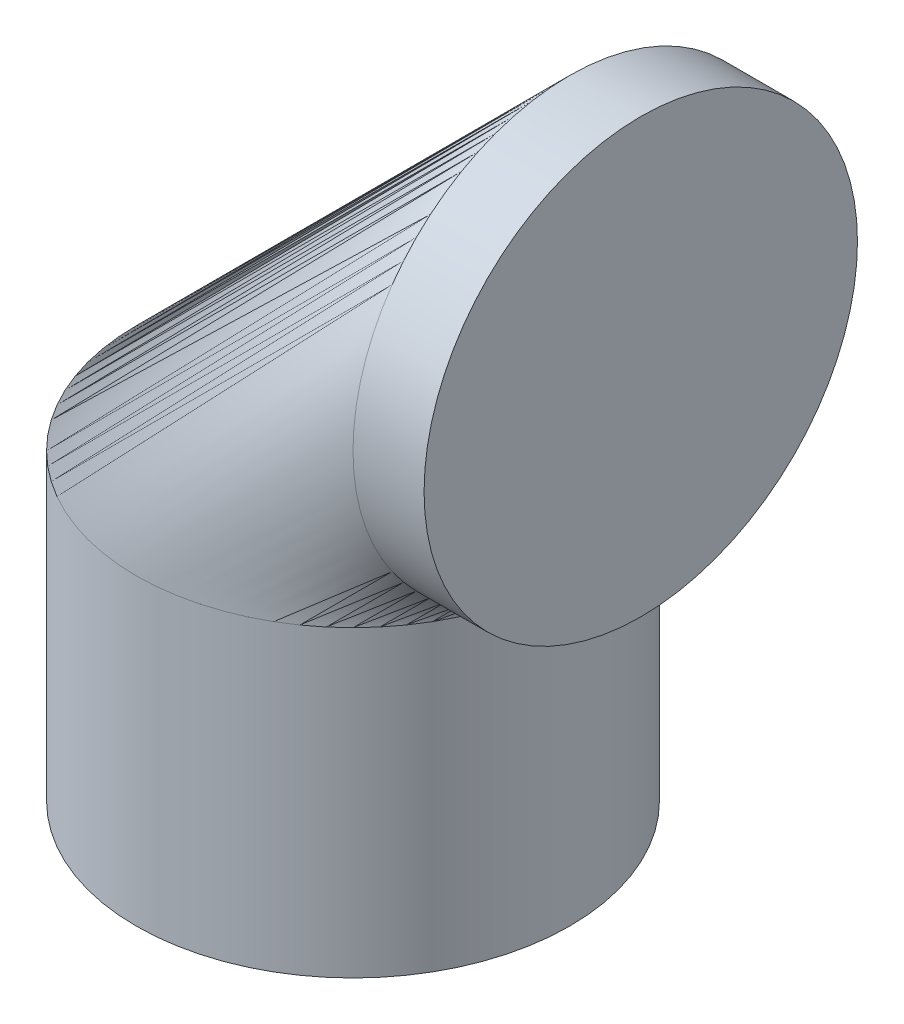
from build123d import *

# Parameters (mm, degrees)
SKETCH5_R = 25


with BuildPart() as part:
    # Sweep2: sweep along a path in Sketch4
    with BuildLine(Plane.XY) as sweep2_path:
        Line((0, 0), (0, 35))
        ThreePointArc((0, 35), (7.32233047, 52.67766953), (25, 60))
        Line((25, 60), (33.2, 60))
    # Sketch5 → Sweep2 (sweep)
    with BuildSketch(Plane(origin=(0, 0, 0), x_dir=(1, 0, 0), z_dir=(0, 1, 0))):
        Circle(SKETCH5_R)
    sweep(path=sweep2_path.line)


solid = part.part
